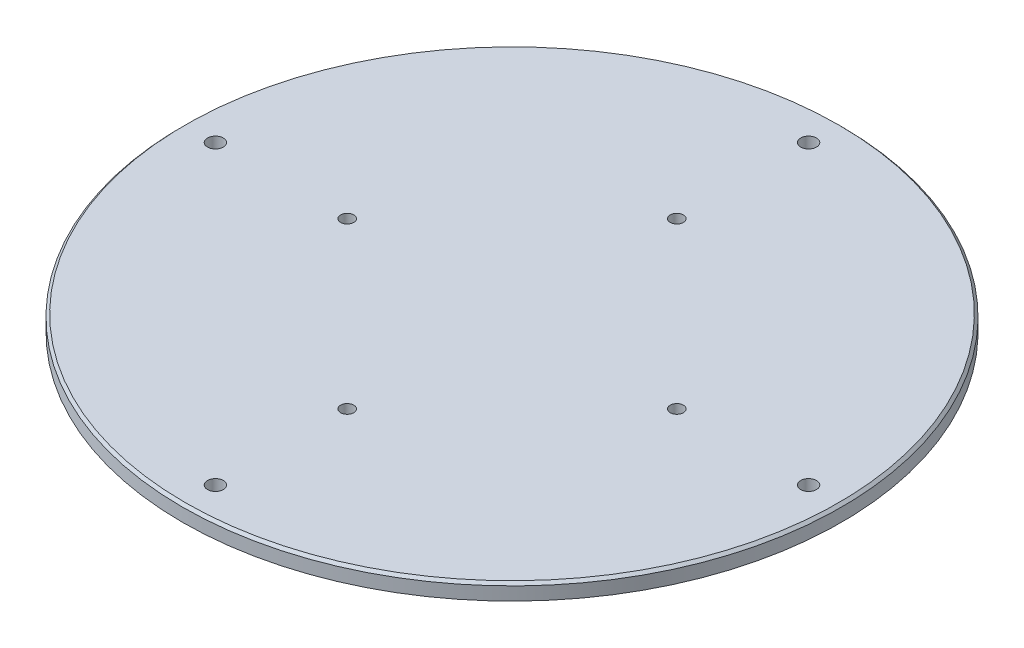
from build123d import *

# Parameters (mm, degrees)
SKETCH_1_R          = 125
EXTRUDE_1_DEPTH     = 6
SKETCH_3_R          = 3
CUT_EXTRUDE_2_DEPTH = 10
SKETCH_4_R          = 2.5
CUT_EXTRUDE_3_DEPTH = 10
CHAMFER_1_SIZE      = 1


with BuildPart() as part:
    # Эскиз1 → Бобышка-Вытянуть1 (new body)
    with BuildSketch(Plane(origin=(0, 0, 0), x_dir=(1, 0, 0), z_dir=(0, 1, 0))):
        with Locations(Location((0, 0, 0), (0, 0, 270))):
            Circle(SKETCH_1_R)
    extrude(amount=EXTRUDE_1_DEPTH)

    # Эскиз3 → Вырез-Вытянуть2 (cut)
    with BuildSketch(Plane(origin=(0, 6, 0), x_dir=(1, 0, 0), z_dir=(0, 1, 0))):
        with Locations(Location((0, 112.5, 0), (0, 0, 270))):
            Circle(SKETCH_3_R)
        with Locations(Location((-112.5, 0, 0), (0, 0, 270))):
            Circle(SKETCH_3_R)
        with Locations(Location((0, -112.5, 0), (0, 0, 270))):
            Circle(SKETCH_3_R)
        with Locations(Location((112.5, 0, 0), (0, 0, 270))):
            Circle(SKETCH_3_R)
    extrude(amount=-CUT_EXTRUDE_2_DEPTH, mode=Mode.SUBTRACT)

    # Эскиз4 → Вырез-Вытянуть3 (cut)
    with BuildSketch(Plane.XZ):
        with Locations(Location((0, 62.5, 0), (0, 0, 270))):
            Circle(SKETCH_4_R)
        with Locations(Location((0, -62.5, 0), (0, 0, 270))):
            Circle(SKETCH_4_R)
        with Locations(Location((62.5, 0, 0), (0, 0, 270))):
            Circle(SKETCH_4_R)
        with Locations(Location((-62.5, 0, 0), (0, 0, 270))):
            Circle(SKETCH_4_R)
    extrude(amount=-CUT_EXTRUDE_3_DEPTH, mode=Mode.SUBTRACT)

    # Фаска1
    chamfer_1_edges = [part.edges().sort_by_distance(p)[0] for p in [
        (0, 6, -125),
    ]]
    chamfer(chamfer_1_edges, length=CHAMFER_1_SIZE)


solid = part.part
